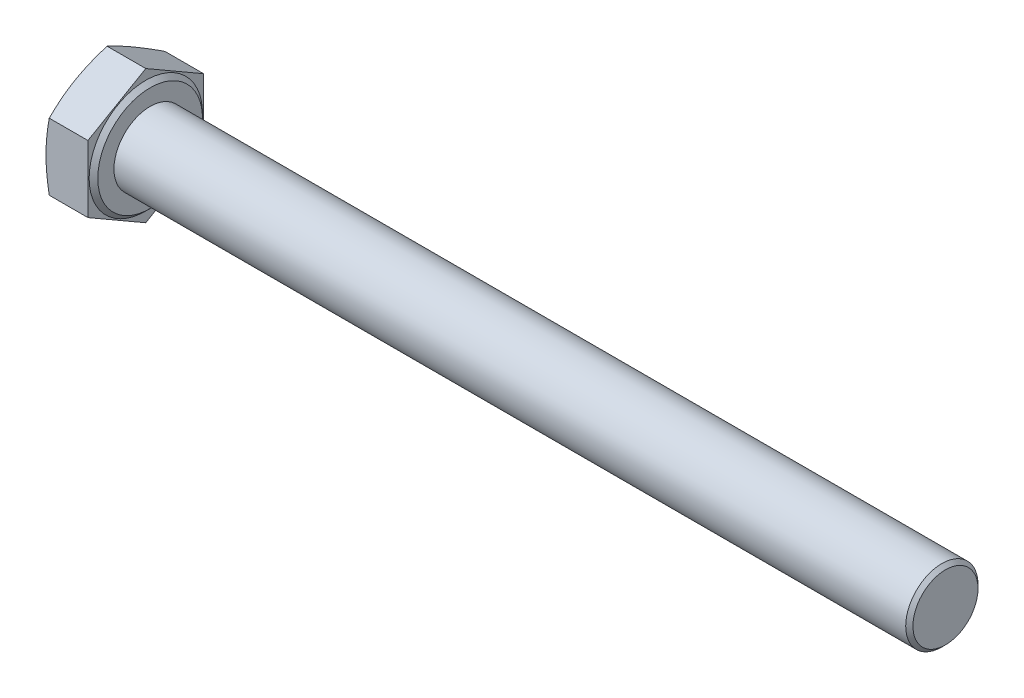
from build123d import *

# Parameters (mm, degrees)
BASEHEAD_DEPTH = 6.4
SKETCH5_R      = 5
BASEBODY_DEPTH = 110
CHAMFER1_SIZE  = 0.5


with BuildPart() as part:
    # Sketch2 → BaseHead (new body)
    with BuildSketch(Plane(origin=(0, 0, 0), x_dir=(0, 0, -1), z_dir=(1, 0, 0))):
        Polygon((0, -9.237604307), (8, -4.618802154), (8, 4.618802154), (0, 9.237604307), (-8, 4.618802154), (-8, -4.618802154), align=None)
    extrude(amount=BASEHEAD_DEPTH)

    # Sketch3 → BearingFace (revolve, cut)
    with BuildSketch(Plane.XY, mode=Mode.PRIVATE) as bearingface_sk:
        Polygon((6.4, 9.237604307), (6.4, 7.235), (5.8, 7.835), (5.8, 9.237604307), align=None)
    revolve(bearingface_sk.sketch.rotate(Axis((-0.957090588, 0, 0), (1, 0, 0)), 90), axis=Axis((-0.957090588, 0, 0), (1, 0, 0)), mode=Mode.SUBTRACT)

    # Sketch4 → HeadChamfer (revolve, cut)
    with BuildSketch(Plane.XY):
        Polygon((0, 9.237604307), (0.45045113, 9.237604307), (0, 8), align=None)
    revolve(axis=Axis((-0.493528746, 0, 0), (1, 0, 0)), mode=Mode.SUBTRACT)

    # Sketch5 → BaseBody (add)
    with BuildSketch(Plane(origin=(6.4, 0, 0), x_dir=(0, 0, -1), z_dir=(1, 0, 0))):
        with Locations(Location((0, 0, 0), (0, 0, 180))):
            Circle(SKETCH5_R)
    extrude(amount=BASEBODY_DEPTH)

    # Chamfer1
    chamfer1_edges = [part.edges().sort_by_distance(p)[0] for p in [
        (116.4, 0, -5),
    ]]
    chamfer(chamfer1_edges, length=CHAMFER1_SIZE)


solid = part.part
